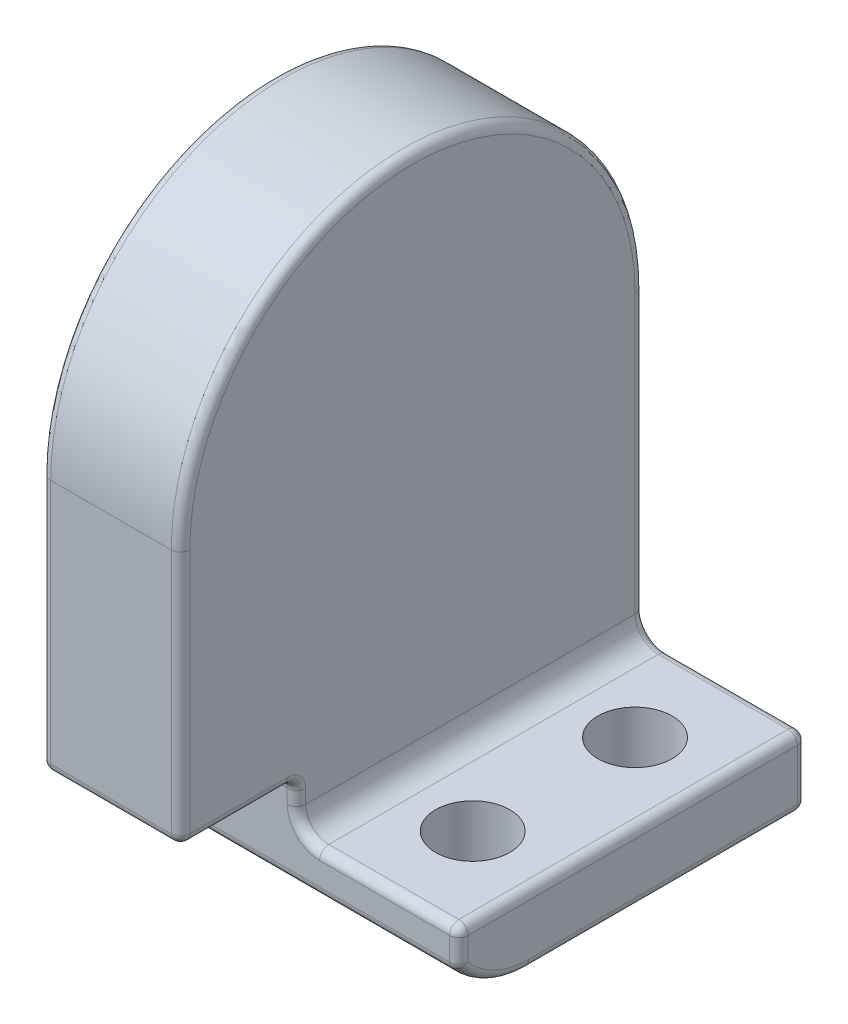
from build123d import *

# Parameters (mm, degrees)
SKETCH_1_R          = 3
EXTRUDE_1_DEPTH     = 3
SKETCH_2_W          = 3.5
SKETCH_2_H          = 10
SKETCH_2_R          = 0.8
EXTRUDE_2_DEPTH     = 1.5
SKETCH_5_W          = 6.5
SKETCH_5_H          = 2.5
CUT_EXTRUDE_1_DEPTH = 2.5
CUT_EXTRUDE_2_REACH = 13.456
FILLET_1_R          = 0.5
FILLET_2_R          = 0.2
CHAMFER_1_SIZE      = 0.2
SKETCH_3_R          = 3.977941141
EXTRUDE_3_DEPTH     = 0.4


with BuildPart() as part:
    # 草图1 → 凸台-拉伸1 (new body)
    with BuildSketch(Plane(origin=(0, 0, 0), x_dir=(0, 0, -1), z_dir=(1, 0, 0))):
        with BuildLine():
            Line((-5, 0), (-5, -8))
            Line((-5, -8), (5, -8))
            Line((5, -8), (5, 0))
            ThreePointArc((5, 0), (0, 5), (-5, 0))
        make_face()
        Circle(SKETCH_1_R, mode=Mode.SUBTRACT)
    extrude(amount=EXTRUDE_1_DEPTH)

    # 草图2 → 凸台-拉伸2 (add)
    with BuildSketch(Plane.XZ.offset(8)):
        with Locations((4.75, 0)):
            Rectangle(SKETCH_2_W, SKETCH_2_H)
        with Locations(Location((4.8, -3, 0), (0, 0, 270))):
            Circle(SKETCH_2_R, mode=Mode.SUBTRACT)
        with Locations(Location((4.8, 0.5, 0), (0, 0, 270))):
            Circle(SKETCH_2_R, mode=Mode.SUBTRACT)
    extrude(amount=-EXTRUDE_2_DEPTH)

    # 草图5 → 切除-拉伸1 (cut)
    with BuildSketch(Plane.XZ.offset(8)):
        with Locations((3.25, 3.75)):
            Rectangle(SKETCH_5_W, SKETCH_5_H)
    extrude(amount=-CUT_EXTRUDE_1_DEPTH, mode=Mode.SUBTRACT)

    # 草图6 → 切除-拉伸2 (cut, up to next)
    with BuildSketch(Plane.ZY, mode=Mode.PRIVATE) as cut_extrude_2_sk1:
        with BuildLine():
            Line((2.897366596, -6), (3.27705392, -6))
            Line((3.27705392, -6), (3.27705392, -8.325127743))
            Line((3.27705392, -8.325127743), (1, -8.325127743))
            Line((1, -8.325127743), (1, -8))
            ThreePointArc((1, -8), (2.378404875, -7.407669683), (2.897366596, -6))
        make_face()
    cut_extrude_2_tool1 = extrude(cut_extrude_2_sk1.sketch, amount=-CUT_EXTRUDE_2_REACH, mode=Mode.PRIVATE) & part.part
    add(cut_extrude_2_tool1.solids().sort_by_distance((0, -7.575754, 2.569334))[0], mode=Mode.SUBTRACT)

    # 圆角1
    fillet_1_edges = [part.edges().sort_by_distance(p)[0] for p in [
        (3, -6.5, -1.25),
    ]]
    fillet(fillet_1_edges, radius=FILLET_1_R)

    # 圆角2
    fillet_2_edges = [part.edges().sort_by_distance(p)[0] for p in [
        (6.5, -6.5, -1.25),
        (6.5, -7.25, -5),
        (6.5, -8, -2),
        (3, 5, 0),
        (0, -5.5, 3.75),
        (0, -6.383095189, 2.5),
        (1.5, -5.5, 5),
        (6.5, -6.883095189, 2.5),
        (1.5, -5.5, 2.5),
        (3, -5.5, 3.75),
        (0, -4, -5),
        (0, -2.75, 5),
        (0, 5, 0),
        (0, -8, -2),
        (3.25, -7.266190379, 2.5),
        (6.5, -7.806716397, 1.834936608),
        (0, -7.806716397, 1.834936608),
        (3, -5.75, 2.5),
        (3, -3, -5),
        (5, -6.5, 2.5),
        (3, -2.75, 5),
        (5, -6.5, -5),
        (3.146446609, -6.353553391, -5),
        (3.146446609, -6.353553391, 2.5),
        (3.25, -8, -5),
    ]]
    fillet(fillet_2_edges, radius=FILLET_2_R)

    # 倒角1
    chamfer_1_edges = [part.edges().sort_by_distance(p)[0] for p in [
        (0, 0, 3),
        (3, 0, 3),
    ]]
    chamfer(chamfer_1_edges, length=CHAMFER_1_SIZE)

    # 草图3 → 凸台-拉伸3 (add)
    with BuildSketch(Plane(origin=(3, 0, 0), x_dir=(0, 0, -1), z_dir=(1, 0, 0))):
        Circle(SKETCH_3_R)
    extrude(amount=-EXTRUDE_3_DEPTH)


solid = part.part
